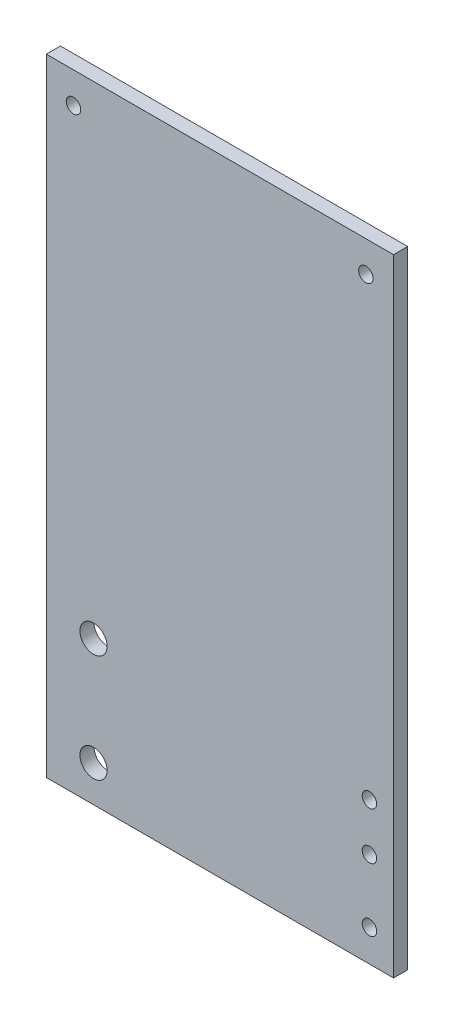
from build123d import *

# Parameters (mm, degrees)
SKETCH1_W           = 19.43
SKETCH1_H           = 35.05
BOARD_OUTLINE_DEPTH = 0.79
SKETCH2_R           = 0.405
SKETCH2_R_2         = 0.76
PTH_DEPTH           = 41.083057518


with BuildPart() as part:
    # Sketch1 → Board_Outline (new body)
    with BuildSketch(Plane.XY):
        with Locations((9.715, 17.525)):
            Rectangle(SKETCH1_W, SKETCH1_H)
    extrude(amount=BOARD_OUTLINE_DEPTH)

    # Sketch2 → PTH (cut, through all)
    with BuildSketch(Plane.XY):
        with Locations((18.08, 5.31)):
            Circle(SKETCH2_R)
        with Locations((17.88, 33.32)):
            Circle(SKETCH2_R)
        with Locations(Location((2.64, 8.05, 0), (0, 0, 180))):
            Circle(SKETCH2_R_2)
        with Locations(Location((2.64, 2.03, 0), (0, 0, 180))):
            Circle(SKETCH2_R_2)
        with Locations((18.08, 7.96)):
            Circle(SKETCH2_R)
        with Locations((1.52, 33.32)):
            Circle(SKETCH2_R)
        with Locations((18.08, 1.78)):
            Circle(SKETCH2_R)
    extrude(amount=PTH_DEPTH, mode=Mode.SUBTRACT)


solid = part.part
